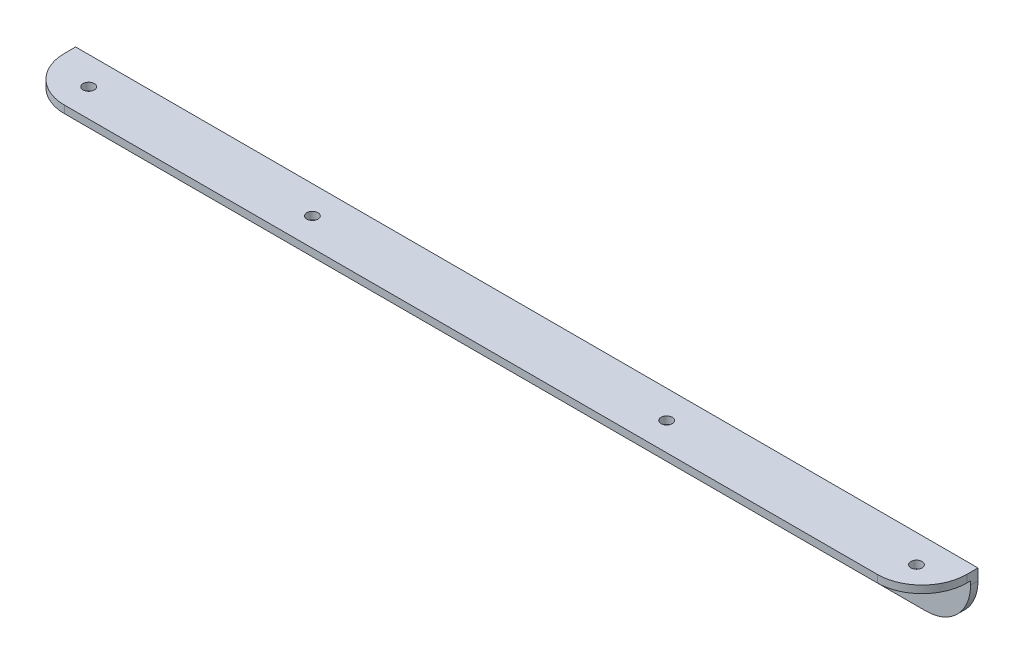
from build123d import *

# Parameters (mm, degrees)
SKETCH1_W           = 242
SKETCH1_H           = 13
SKETCH1_R           = 1.5
BOSS_EXTRUDE1_DEPTH = 2
CUT_EXTRUDE1_REACH  = 123.713
SKETCH2_W           = 30
SKETCH2_H           = 4
SKETCH3_W           = 242
SKETCH3_H           = 2
BOSS_EXTRUDE2_DEPTH = 15
CUT_EXTRUDE2_REACH  = 124.845
SKETCH4_R           = 1.5
FILLET1_R           = 12


with BuildPart() as part:
    # Sketch1 → Boss-Extrude1 (new body)
    with BuildSketch(Plane.XY):
        with Locations((0, -6.5)):
            Rectangle(SKETCH1_W, SKETCH1_H)
        with Locations((-114, -6.5)):
            Circle(SKETCH1_R, mode=Mode.SUBTRACT)
        with Locations((-44, -6.5)):
            Circle(SKETCH1_R, mode=Mode.SUBTRACT)
        with Locations((-24, -6.5)):
            Circle(SKETCH1_R, mode=Mode.SUBTRACT)
        with Locations((27, -6.5)):
            Circle(SKETCH1_R, mode=Mode.SUBTRACT)
        with Locations((97, -6.5)):
            Circle(SKETCH1_R, mode=Mode.SUBTRACT)
    extrude(amount=BOSS_EXTRUDE1_DEPTH)

    # Sketch2 → Cut-Extrude1 (cut, up to next)
    with BuildSketch(Plane.XY.offset(2), mode=Mode.PRIVATE) as cut_extrude1_sk1:
        with Locations((-3, -11)):
            Rectangle(SKETCH2_W, SKETCH2_H)
    cut_extrude1_tool1 = extrude(cut_extrude1_sk1.sketch, amount=-CUT_EXTRUDE1_REACH, mode=Mode.PRIVATE) & part.part
    add(cut_extrude1_tool1.solids().sort_by_distance((-3, -11, 2))[0], mode=Mode.SUBTRACT)

    # Sketch3 → Boss-Extrude2 (add)
    with BuildSketch(Plane.XY):
        with Locations((0, 1)):
            Rectangle(SKETCH3_W, SKETCH3_H)
    extrude(amount=BOSS_EXTRUDE2_DEPTH)

    # Sketch4 → Cut-Extrude2 (cut, up to next)
    with BuildSketch(Plane(origin=(0, 2, 0), x_dir=(1, 0, 0), z_dir=(0, 1, 0)), mode=Mode.PRIVATE) as cut_extrude2_sk1:
        with Locations(Location((-110, -7.5, 0), (0, 0, 270))):
            Circle(SKETCH4_R)
    cut_extrude2_tool1 = extrude(cut_extrude2_sk1.sketch, amount=-CUT_EXTRUDE2_REACH, mode=Mode.PRIVATE) & part.part
    # Sketch4 → Cut-Extrude2 (cut, up to next)
    with BuildSketch(Plane(origin=(0, 2, 0), x_dir=(1, 0, 0), z_dir=(0, 1, 0)), mode=Mode.PRIVATE) as cut_extrude2_sk2:
        with Locations(Location((-50, -7.5, 0), (0, 0, 270))):
            Circle(SKETCH4_R)
    cut_extrude2_tool2 = extrude(cut_extrude2_sk2.sketch, amount=-CUT_EXTRUDE2_REACH, mode=Mode.PRIVATE) & part.part
    # Sketch4 → Cut-Extrude2 (cut, up to next)
    with BuildSketch(Plane(origin=(0, 2, 0), x_dir=(1, 0, 0), z_dir=(0, 1, 0)), mode=Mode.PRIVATE) as cut_extrude2_sk3:
        with Locations(Location((45, -7.5, 0), (0, 0, 270))):
            Circle(SKETCH4_R)
    cut_extrude2_tool3 = extrude(cut_extrude2_sk3.sketch, amount=-CUT_EXTRUDE2_REACH, mode=Mode.PRIVATE) & part.part
    # Sketch4 → Cut-Extrude2 (cut, up to next)
    with BuildSketch(Plane(origin=(0, 2, 0), x_dir=(1, 0, 0), z_dir=(0, 1, 0)), mode=Mode.PRIVATE) as cut_extrude2_sk4:
        with Locations(Location((112, -7.5, 0), (0, 0, 270))):
            Circle(SKETCH4_R)
    cut_extrude2_tool4 = extrude(cut_extrude2_sk4.sketch, amount=-CUT_EXTRUDE2_REACH, mode=Mode.PRIVATE) & part.part
    add(cut_extrude2_tool1.solids().sort_by_distance((-110, 2, 7.5))[0], mode=Mode.SUBTRACT)
    add(cut_extrude2_tool2.solids().sort_by_distance((-50, 2, 7.5))[0], mode=Mode.SUBTRACT)
    add(cut_extrude2_tool3.solids().sort_by_distance((45, 2, 7.5))[0], mode=Mode.SUBTRACT)
    add(cut_extrude2_tool4.solids().sort_by_distance((112, 2, 7.5))[0], mode=Mode.SUBTRACT)

    # Fillet1
    fillet1_edges = [part.edges().sort_by_distance(p)[0] for p in [
        (-121, 1, 15),
        (121, 1, 15),
        (121, -13, 1),
        (-121, -13, 1),
    ]]
    fillet(fillet1_edges, radius=FILLET1_R)


solid = part.part
